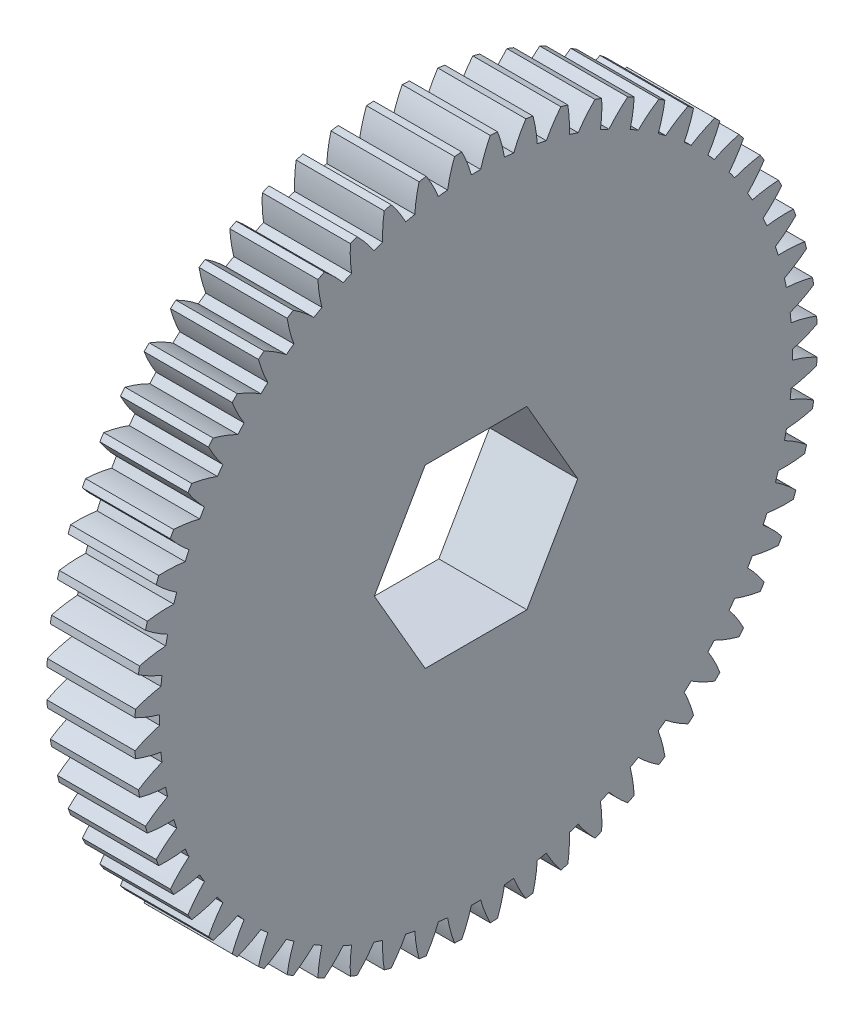
from build123d import *

# Parameters (mm, degrees)
BASPROSKE_W        = 6.35
BASPROSKE_H        = 24.60625
TOOTHCUT_DEPTH     = 36.373119429
TEETHCUTS_COUNT    = 60
TEETHCUTS_ANGLE    = 354
CUT_EXTRUDE2_DEPTH = 36.34318904


with BuildPart() as part:
    # BasProSke → Base-Revolve (revolve)
    with BuildSketch(Plane(origin=(0, 0, 0), x_dir=(1, 0, 0), z_dir=(0, 1, 0)), mode=Mode.PRIVATE) as base_revolve_sk:
        with Locations((3.175, 12.303125)):
            Rectangle(BASPROSKE_W, BASPROSKE_H)
    revolve(base_revolve_sk.sketch.rotate(Axis((-10, 0, 0), (1, 0, 0)), 180), axis=Axis((-10, 0, 0), (1, 0, 0)))

    # TooCutSke → ToothCut (cut, through all)
    with BuildSketch(Plane(origin=(0, 0, 0), x_dir=(0, 0, -1), z_dir=(1, 0, 0))):
        with BuildLine():
            ThreePointArc((0.335692083, 22.806729609), (0, 22.8092), (-0.335692083, 22.806729609))
            ThreePointArc((-0.335692083, 22.806729609), (-0.642658156, 23.726155346), (-1.041479227, 24.609622158))
            ThreePointArc((-1.041479227, 24.609622158), (0, 24.63165), (1.041479227, 24.609622158))
            ThreePointArc((1.041479227, 24.609622158), (0.642658156, 23.726155346), (0.335692083, 22.806729609))
        make_face()
    toothcut = extrude(amount=TOOTHCUT_DEPTH, mode=Mode.SUBTRACT)

    # TeethCuts: ToothCut ×60 about axis
    teethcuts_axis = Axis((-10, 0, 0), (1, 0, 0))
    for i in range(1, TEETHCUTS_COUNT):
        add(toothcut.rotate(teethcuts_axis, i * TEETHCUTS_ANGLE / (TEETHCUTS_COUNT - 1)), mode=Mode.SUBTRACT)

    # Sketch3 → Cut-Extrude2 (cut, through all)
    with BuildSketch(Plane(origin=(6.35, 0, 0), x_dir=(0, 0, -1), z_dir=(1, 0, 0))):
        Polygon((-3.666174209, 6.35), (-7.332348419, 0), (-3.666174209, -6.35), (3.666174209, -6.35), (7.332348419, 0), (3.666174209, 6.35), align=None)
    extrude(amount=-CUT_EXTRUDE2_DEPTH, mode=Mode.SUBTRACT)


solid = part.part
